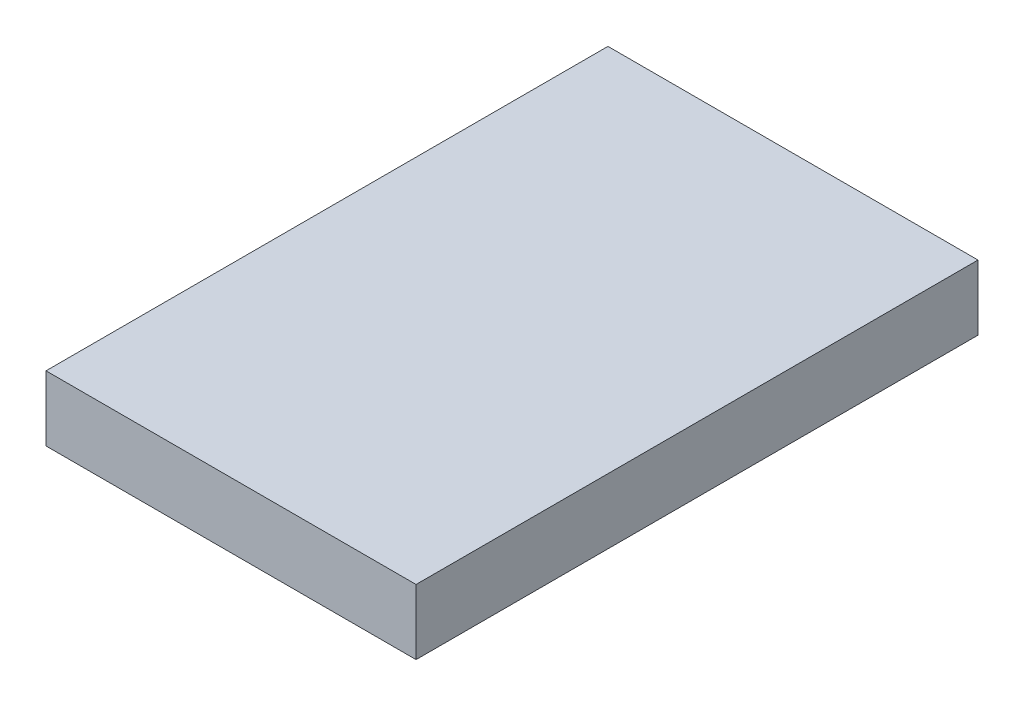
from build123d import *

# Parameters (mm, degrees)
ESBO_O1_W                = 54
ESBO_O1_H                = 82
RESSALTO_EXTRUS_O1_DEPTH = 9.5


with BuildPart() as part:
    # Esboço1 → Ressalto-extrusão1 (new body)
    with BuildSketch(Plane(origin=(0, 0, 0), x_dir=(1, 0, 0), z_dir=(0, 1, 0))):
        Rectangle(ESBO_O1_W, ESBO_O1_H)
    extrude(amount=RESSALTO_EXTRUS_O1_DEPTH)


solid = part.part
